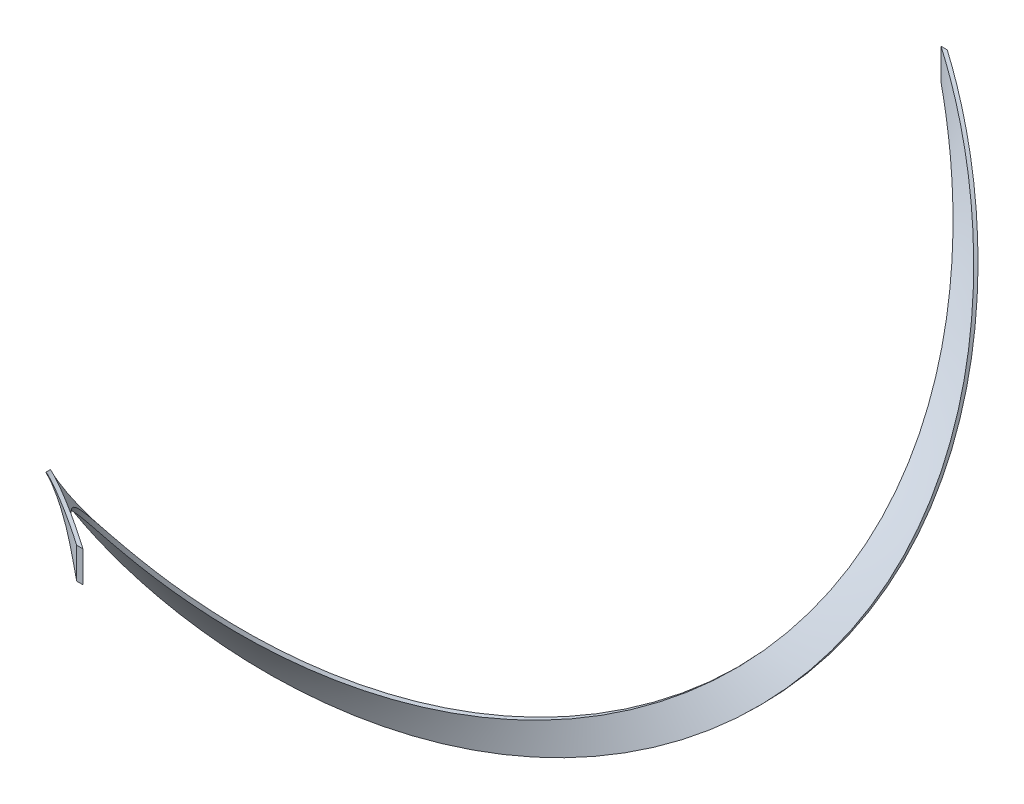
from build123d import *

# Parameters (mm, degrees)
SWEEP1_PITCH       = 833
SWEEP1_HEIGHT      = 833
SWEEP1_RADIUS      = 190.5
SWEEP1_START_ANGLE = -180
SKETCH2_W          = 6
SKETCH2_H          = 30


with BuildPart() as part:
    # Sweep1: sweep along a helix
    with BuildLine() as sweep1_path:
        add(Helix(SWEEP1_PITCH, SWEEP1_HEIGHT, SWEEP1_RADIUS, center=(0, 0, 0), direction=(0, 0, 1), lefthand=True, mode=Mode.PRIVATE).rotate(Axis((0, 0, 0), (0, 0, 1)), SWEEP1_START_ANGLE))
    # Sketch2 → Sweep1 (sweep)
    with BuildSketch(Plane.XY):
        with Locations((0, 175.476376488)):
            Rectangle(SKETCH2_W, SKETCH2_H)
    sweep(path=sweep1_path.line, is_frenet=True)


solid = part.part
